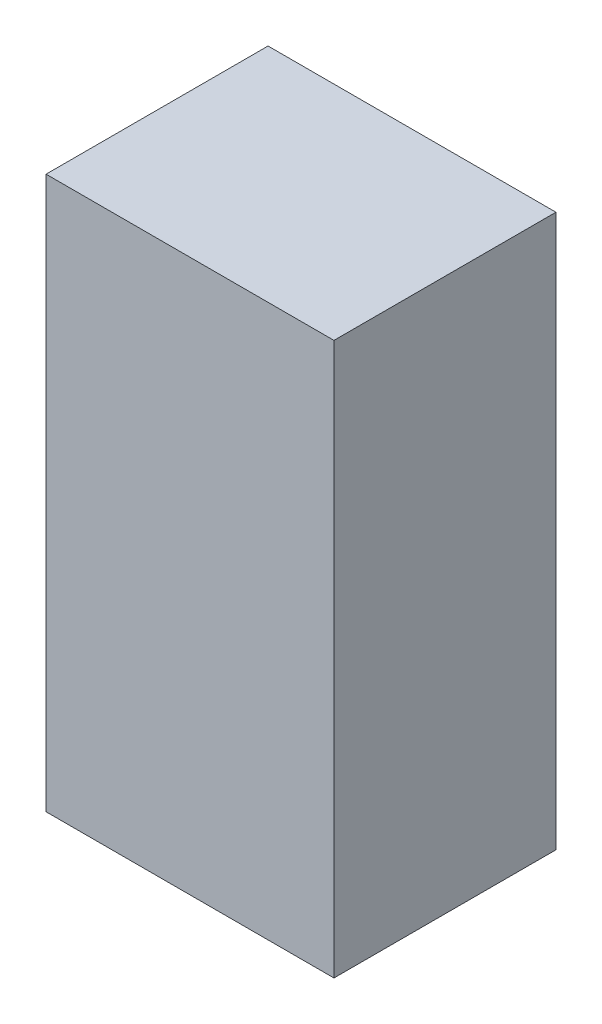
from build123d import *

# Parameters (mm, degrees)
BOSS_EXTRUDE1_DEPTH      = 4.765
BOSS_EXTRUDE1_DEPTH_BACK = 4.765
CUT_EXTRUDE1_DEPTH       = 134.257142857
CUT_EXTRUDE2_DEPTH       = 176.166857025
BOSS_EXTRUDE2_DEPTH      = 25.4
BOSS_EXTRUDE3_REACH      = 168.247
BOSS_EXTRUDE4_REACH      = 162.602
CUT_EXTRUDE4_DEPTH       = 176.073535498
CUT_EXTRUDE4_DEPTH_BACK  = 176.073535498
SKETCH8_W                = 29.497845824
SKETCH8_H                = 11.821808138
BOSS_EXTRUDE5_REACH      = 162.602
SKETCH10_W               = 677.744852518
SKETCH10_H               = 522.587521888
BOSS_EXTRUDE6_DEPTH      = 1300


with BuildPart() as part:
    # Sketch1 → Boss-Extrude1 (new, two sides: drawn at the far end of the back side and taken through both)
    with BuildSketch(Plane.XY.offset(-BOSS_EXTRUDE1_DEPTH_BACK)):
        Polygon((0, 0), (150.63, 0), (87.13, 88.9), (12.3, 88.9), align=None)
    extrude(amount=BOSS_EXTRUDE1_DEPTH + BOSS_EXTRUDE1_DEPTH_BACK)

    # Sketch2 → Cut-Extrude1 (cut, along a direction that is not the sketch's normal)
    with BuildSketch(Plane.XZ):
        Polygon((150.63, 0), (133.34, 4.765), (171.670273927, 17.698707495), (171.005533739, -7.644512157), (148.071997267, -23.348999089), (133.34, -4.765), align=None)
    extrude(amount=-CUT_EXTRUDE1_DEPTH, dir=(0.5812381937190965, -0.8137334712067349, 0), mode=Mode.SUBTRACT)

    # Sketch3 → Cut-Extrude2 (cut, through all)
    with BuildSketch(Plane.XY.offset(4.765)):
        Polygon((29.799719665, 76.3835184), (10.929478609, 78.99436165), (7.448354274, 53.834040242), (26.31859533, 51.223196991), align=None)
    extrude(amount=-CUT_EXTRUDE2_DEPTH, mode=Mode.SUBTRACT)

    # Sketch4 → Boss-Extrude2 (add)
    with BuildSketch(Plane(origin=(10.929478609, 78.99436165, 0), x_dir=(0.9905638349724135, -0.1370521391469141, 0), z_dir=(-0.1370521391469141, -0.9905638349724135, 0))):
        Polygon((-1.906104256, -1.760525647), (0, -2.096623256), (0, 4.765), (14.191997191, 4.765), (14.245516561, 5.068523432), (-0.251237123, 7.624692239), align=None)
        with BuildLine():
            Line((0, -2.096623256), (12.590649428, -4.316694454))
            Line((12.590649428, -4.316694454), (12.940515204, -2.332507041))
            ThreePointArc((12.940515204, -2.332507041), (12.103172864, 0.607768622), (13.895650785, 3.084336019))
            Line((13.895650785, 3.084336019), (14.191997191, 4.765))
            Line((14.191997191, 4.765), (0, 4.765))
            Line((0, 4.765), (0, -2.096623256))
        make_face()
        with BuildLine():
            ThreePointArc((13.895650785, 3.084336019), (12.103172864, 0.607768622), (12.940515204, -2.332507041))
            Line((12.940515204, -2.332507041), (13.895650785, 3.084336019))
        make_face()
        with BuildLine():
            ThreePointArc((12.940515204, -2.332507041), (14.942231378, -3.446827136), (17.204349215, -3.084336019))
            Line((17.204349215, -3.084336019), (18.159484796, 2.332507041))
            ThreePointArc((18.159484796, 2.332507041), (16.157768622, 3.446827136), (13.895650785, 3.084336019))
            Line((13.895650785, 3.084336019), (12.940515204, -2.332507041))
        make_face()
        with BuildLine():
            ThreePointArc((13.895650785, 3.084336019), (16.157768622, 3.446827136), (18.159484796, 2.332507041))
            Line((18.159484796, 2.332507041), (18.509350572, 4.316694454))
            Line((18.509350572, 4.316694454), (15.966883482, 4.765))
            Line((15.966883482, 4.765), (14.191997191, 4.765))
            Line((14.191997191, 4.765), (13.895650785, 3.084336019))
        make_face()
        Polygon((14.245516561, 5.068523432), (14.191997191, 4.765), (15.966883482, 4.765), align=None)
        with BuildLine():
            Line((12.590649428, -4.316694454), (15.133116518, -4.765))
            Line((15.133116518, -4.765), (16.908002809, -4.765))
            Line((16.908002809, -4.765), (17.204349215, -3.084336019))
            ThreePointArc((17.204349215, -3.084336019), (14.942231378, -3.446827136), (12.940515204, -2.332507041))
            Line((12.940515204, -2.332507041), (12.590649428, -4.316694454))
        make_face()
        Polygon((15.133116518, -4.765), (16.854483439, -5.068523432), (16.908002809, -4.765), align=None)
    extrude(amount=BOSS_EXTRUDE2_DEPTH)

    # Boss-Extrude3: up to this plane
    boss_extrude3_end = Plane(origin=(18.870241056, -2.610843251, -4.765), z_dir=(-0.9905638349724135, 0.13705213914691478, 0))
    # Sketch5 → Boss-Extrude3 (add, up to the surface)
    with BuildSketch(Plane(origin=(17.050602168, -2.35908219, -3.035121103), x_dir=(-0.1720096048057269, 0.02379885420821639, -0.9848077530122078), z_dir=(0.9755149445343381, -0.134970009198789, -0.17364817766693175)), mode=Mode.PRIVATE) as boss_extrude3_sk1:
        Polygon((1.756565067, 54.346866241), (2.064770837, 54.346866241), (2.064770837, 79.746866241), (1.756565067, 79.746866241), (-7.465229163, 79.746866241), (-7.465229163, 54.346866241), align=None)
    boss_extrude3_tool1 = split(extrude(boss_extrude3_sk1.sketch, amount=BOSS_EXTRUDE3_REACH, dir=(1, 0, 0), mode=Mode.PRIVATE), bisect_by=boss_extrude3_end, keep=Keep.BOTH, mode=Mode.PRIVATE)
    add(boss_extrude3_tool1.solids().sort_by_distance((26.703984, 63.990856, -0.375914))[0])

    # Boss-Extrude4: up to this face of the body (flat: up to its plane)
    boss_extrude4_end = Plane(part.part.faces().sort_by_distance((18.23182988, 65.163044194, 5.970693347))[0])
    # Sketch6 → Boss-Extrude4 (add, up to the picked face)
    with BuildSketch(Plane(origin=(18.870241056, -2.610843251, 0), x_dir=(0, 0, 1), z_dir=(-0.9905638349724135, 0.1370521391469148, 0)), mode=Mode.PRIVATE) as boss_extrude4_sk1:
        Polygon((4.765, 79.746866241), (4.316694454, 79.746866241), (4.316694454, 54.421669255), (-4.765, 54.643228057), (-4.765, 54.346866241), (4.765, 54.346866241), align=None)
    boss_extrude4_tool1 = split(extrude(boss_extrude4_sk1.sketch, amount=BOSS_EXTRUDE4_REACH, mode=Mode.PRIVATE), bisect_by=boss_extrude4_end, keep=Keep.BOTH, mode=Mode.PRIVATE)
    add(boss_extrude4_tool1.solids().sort_by(Axis((29.762539, 76.114789, 4.540847), (-0.9905638349724135, 0.1370521391469148, 0)))[0])

    # Sketch8 → Cut-Extrude4 (cut, two sides: drawn at the far end of the back side and taken through both)
    with BuildSketch(Plane(origin=(0, 88.9, 0), x_dir=(1, 0, 0), z_dir=(0, 1, 0)).offset(-CUT_EXTRUDE4_DEPTH_BACK)):
        with Locations((33.561006967, 10.675904069)):
            Rectangle(SKETCH8_W, SKETCH8_H)
    extrude(amount=CUT_EXTRUDE4_DEPTH + CUT_EXTRUDE4_DEPTH_BACK, mode=Mode.SUBTRACT)

    # Sketch9 → Boss-Extrude5 (add, up to next)
    with BuildSketch(Plane(origin=(18.870241056, -2.610843251, 0), x_dir=(0, 0, 1), z_dir=(-0.9905638349724135, 0.1370521391469148, 0)), mode=Mode.PRIVATE) as boss_extrude5_sk1:
        Polygon((4.221363373, 54.346866241), (4.221363373, 54.423994971), (-4.765, 54.643228057), (-4.765, 54.346866241), align=None)
    boss_extrude5_tool1 = extrude(boss_extrude5_sk1.sketch, amount=BOSS_EXTRUDE5_REACH, mode=Mode.PRIVATE) - part.part
    add(boss_extrude5_tool1.solids().sort_by_distance((26.332862, 51.326311, -1.150961))[0])


with BuildPart() as body_2:
    # Sketch10 → Boss-Extrude6 (new body)
    # profile 1 of 2: a face of its own
    with BuildSketch(Plane.XZ):
        Rectangle(SKETCH10_W, SKETCH10_H)
        Polygon((150.63, 0), (133.34, 4.765), (0, 4.765), (0, -4.765), (133.34, -4.765), align=None, mode=Mode.SUBTRACT)
    # profile 2 of 2: a face of its own
    with BuildSketch(Plane.XZ):
        Polygon((133.34, -4.765), (150.63, 0), (133.34, 4.765), (0, 4.765), (0, -4.765), align=None)
    extrude(amount=-BOSS_EXTRUDE6_DEPTH)


solid = Compound([part.part, body_2.part])
